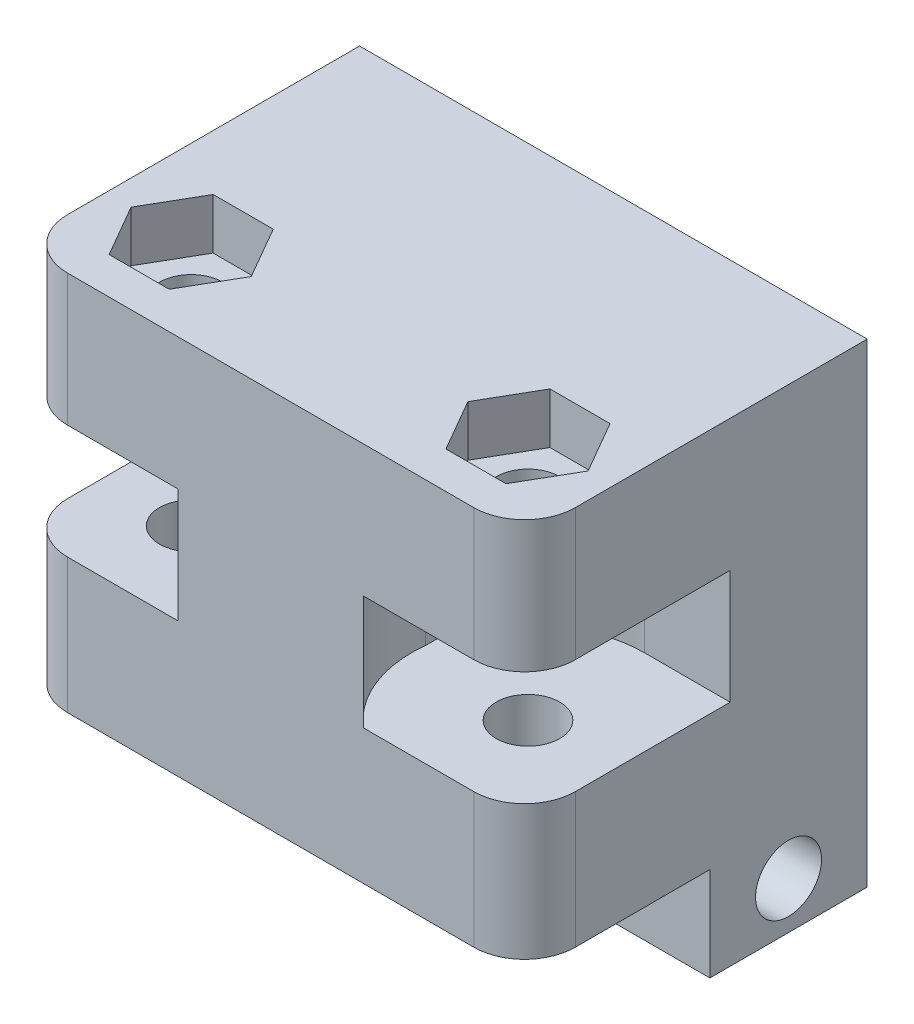
from build123d import *

# Parameters (mm, degrees)
SKETCH1_W           = 40
SKETCH1_H           = 27
BOSS_EXTRUDE1_DEPTH = 30
CUT_EXTRUDE1_DEPTH  = 10
SKETCH3_R           = 2.5
CUT_EXTRUDE2_DEPTH  = 30
CUT_EXTRUDE5_START  = -10.62
CUT_EXTRUDE5_DEPTH  = 9
SKETCH10_W          = 20
SKETCH10_H          = 8.2
CUT_EXTRUDE7_DEPTH  = 6.8
SKETCH12_W          = 20
SKETCH12_H          = 8.2
CUT_EXTRUDE10_DEPTH = 6.8
FILLET1_R           = 4
SKETCH13_W          = 12.4
SKETCH13_H          = 7.4
SKETCH13_R          = 2.6
BOSS_EXTRUDE2_DEPTH = 40
CUT_EXTRUDE11_REACH = 42.436
SKETCH14_W          = 20
SKETCH14_H          = 7.4
CUT_EXTRUDE12_START = -4
SKETCH15_R          = 2.5
CUT_EXTRUDE12_DEPTH = 4
SKETCH16_R          = 2.5
CUT_EXTRUDE13_DEPTH = 4


with BuildPart() as part:
    # Sketch1 → Boss-Extrude1 (new body)
    with BuildSketch(Plane(origin=(0, 0, 0), x_dir=(1, 0, 0), z_dir=(0, 1, 0))):
        with Locations((-2.846153846, 4.313186813)):
            Rectangle(SKETCH1_W, SKETCH1_H)
    extrude(amount=BOSS_EXTRUDE1_DEPTH)

    # Sketch2 → Cut-Extrude1 (cut)
    with BuildSketch(Plane(origin=(0, 0, -17.813186813), x_dir=(-1, 0, 0), z_dir=(0, 0, -1))):
        Polygon((-8.086431081, 26), (-8.086431081, 4), (-0.206431081, 4), (-0.206431081, 7), (-2.866431081, 7), (-2.866431081, 8.008707537), (-0.253846154, 10.628707537), (5.946153846, 10.628707537), (8.558738773, 8.008707537), (8.558738773, 7), (5.898738773, 7), (5.898738773, 4), (13.778738773, 4), (13.778738773, 26), (5.898738773, 26), (5.898738773, 23), (8.558738773, 23), (8.558738773, 21.991292463), (5.938738773, 19.378707537), (-0.246431081, 19.378707537), (-2.866431081, 21.991292463), (-2.866431081, 23), (-0.206431081, 23), (-0.206431081, 26), align=None)
    extrude(amount=-CUT_EXTRUDE1_DEPTH, mode=Mode.SUBTRACT)

    # Sketch3 → Cut-Extrude2 (cut)
    with BuildSketch(Plane.XZ):
        with Locations(Location((10.423846154, 2.186813187, 0), (0, 0, 270))):
            Circle(SKETCH3_R)
        with Locations(Location((-16.116153846, 2.186813187, 0), (0, 0, 90))):
            Circle(SKETCH3_R)
    extrude(amount=-CUT_EXTRUDE2_DEPTH, mode=Mode.SUBTRACT)

    # Sketch8 → Cut-Extrude5 (cut)
    with BuildSketch(Plane.XZ.offset(CUT_EXTRUDE5_START)):
        with BuildLine():
            Line((4.453921531, 9.186813187), (17.153846154, 9.186813187))
            Line((17.153846154, 9.186813187), (17.153846154, -7.013186813))
            Line((17.153846154, -7.013186813), (10.423846154, -7.013186813))
            ThreePointArc((10.423846154, -7.013186813), (1.791349412, -0.994381557), (4.453921531, 9.186813187))
        make_face()
        with BuildLine():
            Line((-22.846153846, -7.013186813), (-16.116153846, -7.013186813))
            ThreePointArc((-16.116153846, -7.013186813), (-7.483657104, -0.994381557), (-10.146229224, 9.186813187))
            Line((-10.146229224, 9.186813187), (-22.846153846, 9.186813187))
            Line((-22.846153846, 9.186813187), (-22.846153846, -7.013186813))
        make_face()
    extrude(amount=-CUT_EXTRUDE5_DEPTH, mode=Mode.SUBTRACT)

    # Sketch10 → Cut-Extrude7 (cut)
    with BuildSketch(Plane.ZY.offset(-8.086431081)):
        with Locations((-7.813186813, 14.72)):
            Rectangle(SKETCH10_W, SKETCH10_H)
    extrude(amount=CUT_EXTRUDE7_DEPTH, mode=Mode.SUBTRACT)

    # Sketch12 → Cut-Extrude10 (cut)
    with BuildSketch(Plane(origin=(-13.778738773, 0, 0), x_dir=(0, 0, -1), z_dir=(1, 0, 0))):
        with Locations((7.813186813, 14.72)):
            Rectangle(SKETCH12_W, SKETCH12_H)
    extrude(amount=CUT_EXTRUDE10_DEPTH, mode=Mode.SUBTRACT)

    # Fillet1
    fillet1_edges = [part.edges().sort_by_distance(p)[0] for p in [
        (17.153846154, 24.81, 9.186813187),
        (-22.846153846, 24.81, 9.186813187),
        (17.153846154, 5.31, 9.186813187),
        (-22.846153846, 5.31, 9.186813187),
    ]]
    fillet(fillet1_edges, radius=FILLET1_R)

    # Sketch13 → Boss-Extrude2 (add)
    with BuildSketch(Plane(origin=(17.153846154, 0, 0), x_dir=(0, 0, -1), z_dir=(1, 0, 0))):
        with Locations((11.613186813, -3.7)):
            Rectangle(SKETCH13_W, SKETCH13_H)
        with Locations((11.613186813, -3.7)):
            Circle(SKETCH13_R, mode=Mode.SUBTRACT)
    extrude(amount=-BOSS_EXTRUDE2_DEPTH)

    # Sketch14 → Cut-Extrude11 (cut, up to next)
    with BuildSketch(Plane.XY.offset(-5.413186813), mode=Mode.PRIVATE) as cut_extrude11_sk1:
        with Locations((-2.846153846, -3.7)):
            Rectangle(SKETCH14_W, SKETCH14_H)
    cut_extrude11_tool1 = extrude(cut_extrude11_sk1.sketch, amount=-CUT_EXTRUDE11_REACH, mode=Mode.PRIVATE) & part.part
    add(cut_extrude11_tool1.solids().sort_by_distance((-2.846154, -3.7, -5.413187))[0], mode=Mode.SUBTRACT)

    # Sketch15 → Cut-Extrude12 (cut)
    # profile 1 of 2: a face of its own
    with BuildSketch(Plane(origin=(0, 30, 0), x_dir=(1, 0, 0), z_dir=(0, 1, 0)).offset(CUT_EXTRUDE12_START)):
        Polygon((12.790982258, -6.286813187), (15.158118361, -2.186813187), (12.790982258, 1.913186813), (8.05671005, 1.913186813), (5.689573946, -2.186813187), (8.05671005, -6.286813187), align=None)
        with Locations(Location((10.423846154, -2.186813187, 0), (0, 0, 90))):
            Circle(SKETCH15_R, mode=Mode.SUBTRACT)
    # profile 2 of 2: a face of its own
    with BuildSketch(Plane(origin=(0, 30, 0), x_dir=(1, 0, 0), z_dir=(0, 1, 0)).offset(CUT_EXTRUDE12_START)):
        Polygon((-13.749017742, -6.286813187), (-11.381881639, -2.186813187), (-13.749017742, 1.913186813), (-18.48328995, 1.913186813), (-20.850426054, -2.186813187), (-18.48328995, -6.286813187), align=None)
        with Locations(Location((-16.116153846, -2.186813187, 0), (0, 0, 90))):
            Circle(SKETCH15_R, mode=Mode.SUBTRACT)
    extrude(amount=CUT_EXTRUDE12_DEPTH, mode=Mode.SUBTRACT)

    # Sketch16 → Cut-Extrude13 (cut)
    # profile 1 of 2: a face of its own
    with BuildSketch(Plane.XZ):
        Polygon((-13.749017742, -1.913186813), (-11.381881639, 2.186813187), (-13.749017742, 6.286813187), (-18.48328995, 6.286813187), (-20.850426054, 2.186813187), (-18.48328995, -1.913186813), align=None)
        with Locations(Location((-16.116153846, 2.186813187, 0), (0, 0, 270))):
            Circle(SKETCH16_R, mode=Mode.SUBTRACT)
    # profile 2 of 2: a face of its own
    with BuildSketch(Plane.XZ):
        Polygon((12.790982258, -1.913186813), (15.158118361, 2.186813187), (12.790982258, 6.286813187), (8.05671005, 6.286813187), (5.689573946, 2.186813187), (8.05671005, -1.913186813), align=None)
        with Locations(Location((10.423846154, 2.186813187, 0), (0, 0, 270))):
            Circle(SKETCH16_R, mode=Mode.SUBTRACT)
    extrude(amount=-CUT_EXTRUDE13_DEPTH, mode=Mode.SUBTRACT)


solid = part.part
